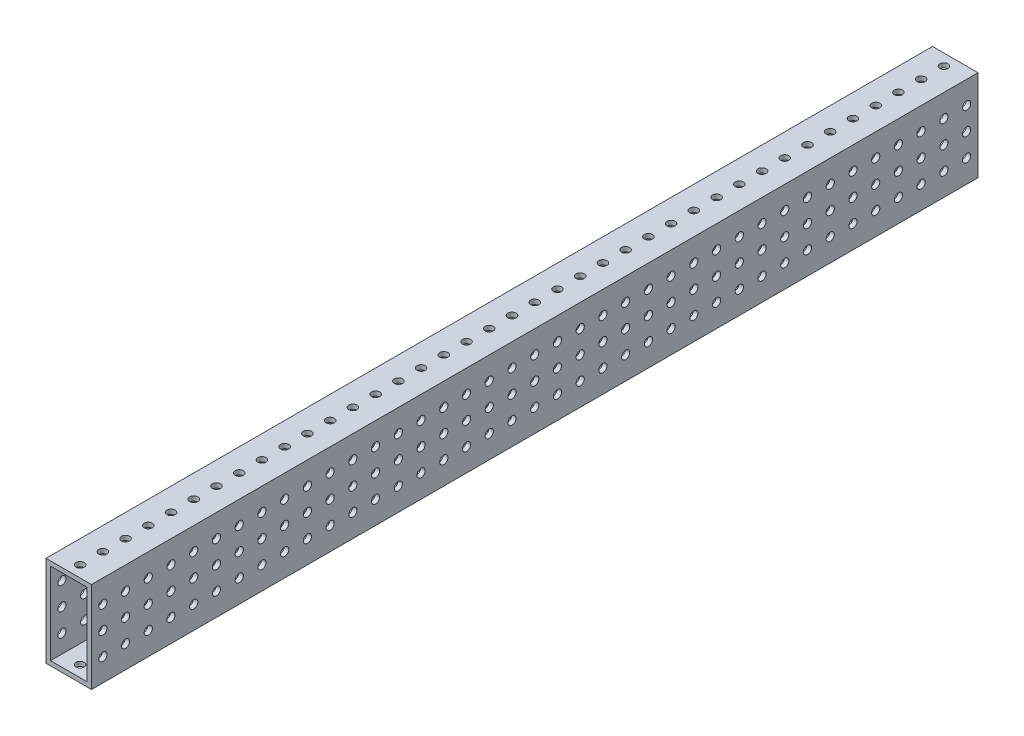
from build123d import *

# Parameters (mm, degrees)
SKETCH1_W           = 25.4
SKETCH1_H           = 50.8
SKETCH1_W_2         = 20.32
SKETCH1_H_2         = 45.72
BOSS_EXTRUDE1_DEPTH = 495.3
SKETCH2_R           = 2.286
CUT_EXTRUDE1_DEPTH  = 25.4
SKETCH4_R           = 2.286
CUT_EXTRUDE2_DEPTH  = 50.8


with BuildPart() as part:
    # Sketch1 → Boss-Extrude1 (new body)
    with BuildSketch(Plane.XY):
        with Locations((-11.984507042, -2.08685446)):
            Rectangle(SKETCH1_W, SKETCH1_H)
        with Locations((-11.984507042, -2.08685446)):
            Rectangle(SKETCH1_W_2, SKETCH1_H_2, mode=Mode.SUBTRACT)
    extrude(amount=BOSS_EXTRUDE1_DEPTH)

    # Sketch2 → Cut-Extrude1 (cut)
    with BuildSketch(Plane(origin=(0.715492958, 0, 0), x_dir=(0, 0, -1), z_dir=(1, 0, 0))):
        with Locations(Location((-488.95, 10.61314554, 0), (0, 0, 90))):
            Circle(SKETCH2_R)
        with Locations(Location((-476.25, 10.61314554, 0), (0, 0, 90))):
            Circle(SKETCH2_R)
        with Locations(Location((-463.55, 10.61314554, 0), (0, 0, 90))):
            Circle(SKETCH2_R)
        with Locations(Location((-450.85, 10.61314554, 0), (0, 0, 90))):
            Circle(SKETCH2_R)
        with Locations(Location((-438.15, 10.61314554, 0), (0, 0, 90))):
            Circle(SKETCH2_R)
        with Locations(Location((-425.45, 10.61314554, 0), (0, 0, 90))):
            Circle(SKETCH2_R)
        with Locations(Location((-412.75, 10.61314554, 0), (0, 0, 90))):
            Circle(SKETCH2_R)
        with Locations(Location((-400.05, 10.61314554, 0), (0, 0, 90))):
            Circle(SKETCH2_R)
        with Locations(Location((-387.35, 10.61314554, 0), (0, 0, 90))):
            Circle(SKETCH2_R)
        with Locations(Location((-374.65, 10.61314554, 0), (0, 0, 90))):
            Circle(SKETCH2_R)
        with Locations(Location((-361.95, 10.61314554, 0), (0, 0, 90))):
            Circle(SKETCH2_R)
        with Locations(Location((-349.25, 10.61314554, 0), (0, 0, 90))):
            Circle(SKETCH2_R)
        with Locations(Location((-336.55, 10.61314554, 0), (0, 0, 90))):
            Circle(SKETCH2_R)
        with Locations(Location((-323.85, 10.61314554, 0), (0, 0, 90))):
            Circle(SKETCH2_R)
        with Locations(Location((-311.15, 10.61314554, 0), (0, 0, 90))):
            Circle(SKETCH2_R)
        with Locations(Location((-298.45, 10.61314554, 0), (0, 0, 90))):
            Circle(SKETCH2_R)
        with Locations(Location((-285.75, 10.61314554, 0), (0, 0, 90))):
            Circle(SKETCH2_R)
        with Locations(Location((-273.05, 10.61314554, 0), (0, 0, 90))):
            Circle(SKETCH2_R)
        with Locations(Location((-260.35, 10.61314554, 0), (0, 0, 90))):
            Circle(SKETCH2_R)
        with Locations(Location((-247.65, 10.61314554, 0), (0, 0, 90))):
            Circle(SKETCH2_R)
        with Locations(Location((-234.95, 10.61314554, 0), (0, 0, 90))):
            Circle(SKETCH2_R)
        with Locations(Location((-222.25, 10.61314554, 0), (0, 0, 90))):
            Circle(SKETCH2_R)
        with Locations(Location((-209.55, 10.61314554, 0), (0, 0, 90))):
            Circle(SKETCH2_R)
        with Locations(Location((-196.85, 10.61314554, 0), (0, 0, 90))):
            Circle(SKETCH2_R)
        with Locations(Location((-184.15, 10.61314554, 0), (0, 0, 90))):
            Circle(SKETCH2_R)
        with Locations(Location((-171.45, 10.61314554, 0), (0, 0, 90))):
            Circle(SKETCH2_R)
        with Locations(Location((-158.75, 10.61314554, 0), (0, 0, 90))):
            Circle(SKETCH2_R)
        with Locations(Location((-146.05, 10.61314554, 0), (0, 0, 90))):
            Circle(SKETCH2_R)
        with Locations(Location((-133.35, 10.61314554, 0), (0, 0, 90))):
            Circle(SKETCH2_R)
        with Locations(Location((-120.65, 10.61314554, 0), (0, 0, 90))):
            Circle(SKETCH2_R)
        with Locations(Location((-107.95, 10.61314554, 0), (0, 0, 90))):
            Circle(SKETCH2_R)
        with Locations(Location((-95.25, 10.61314554, 0), (0, 0, 90))):
            Circle(SKETCH2_R)
        with Locations(Location((-82.55, 10.61314554, 0), (0, 0, 90))):
            Circle(SKETCH2_R)
        with Locations(Location((-69.85, 10.61314554, 0), (0, 0, 90))):
            Circle(SKETCH2_R)
        with Locations(Location((-57.15, 10.61314554, 0), (0, 0, 90))):
            Circle(SKETCH2_R)
        with Locations(Location((-44.45, 10.61314554, 0), (0, 0, 90))):
            Circle(SKETCH2_R)
        with Locations(Location((-31.75, 10.61314554, 0), (0, 0, 90))):
            Circle(SKETCH2_R)
        with Locations(Location((-19.05, 10.61314554, 0), (0, 0, 90))):
            Circle(SKETCH2_R)
        with Locations(Location((-6.35, 10.61314554, 0), (0, 0, 90))):
            Circle(SKETCH2_R)
        with Locations(Location((-476.25, -2.08685446, 0), (0, 0, 90))):
            Circle(SKETCH2_R)
        with Locations(Location((-463.55, -2.08685446, 0), (0, 0, 90))):
            Circle(SKETCH2_R)
        with Locations(Location((-450.85, -2.08685446, 0), (0, 0, 90))):
            Circle(SKETCH2_R)
        with Locations(Location((-438.15, -2.08685446, 0), (0, 0, 90))):
            Circle(SKETCH2_R)
        with Locations(Location((-425.45, -2.08685446, 0), (0, 0, 90))):
            Circle(SKETCH2_R)
        with Locations(Location((-412.75, -2.08685446, 0), (0, 0, 90))):
            Circle(SKETCH2_R)
        with Locations(Location((-400.05, -2.08685446, 0), (0, 0, 90))):
            Circle(SKETCH2_R)
        with Locations(Location((-387.35, -2.08685446, 0), (0, 0, 90))):
            Circle(SKETCH2_R)
        with Locations(Location((-374.65, -2.08685446, 0), (0, 0, 90))):
            Circle(SKETCH2_R)
        with Locations(Location((-361.95, -2.08685446, 0), (0, 0, 90))):
            Circle(SKETCH2_R)
        with Locations(Location((-349.25, -2.08685446, 0), (0, 0, 90))):
            Circle(SKETCH2_R)
        with Locations(Location((-336.55, -2.08685446, 0), (0, 0, 90))):
            Circle(SKETCH2_R)
        with Locations(Location((-323.85, -2.08685446, 0), (0, 0, 90))):
            Circle(SKETCH2_R)
        with Locations(Location((-311.15, -2.08685446, 0), (0, 0, 90))):
            Circle(SKETCH2_R)
        with Locations(Location((-298.45, -2.08685446, 0), (0, 0, 90))):
            Circle(SKETCH2_R)
        with Locations(Location((-285.75, -2.08685446, 0), (0, 0, 90))):
            Circle(SKETCH2_R)
        with Locations(Location((-273.05, -2.08685446, 0), (0, 0, 90))):
            Circle(SKETCH2_R)
        with Locations(Location((-260.35, -2.08685446, 0), (0, 0, 90))):
            Circle(SKETCH2_R)
        with Locations(Location((-247.65, -2.08685446, 0), (0, 0, 90))):
            Circle(SKETCH2_R)
        with Locations(Location((-234.95, -2.08685446, 0), (0, 0, 90))):
            Circle(SKETCH2_R)
        with Locations(Location((-222.25, -2.08685446, 0), (0, 0, 90))):
            Circle(SKETCH2_R)
        with Locations(Location((-209.55, -2.08685446, 0), (0, 0, 90))):
            Circle(SKETCH2_R)
        with Locations(Location((-196.85, -2.08685446, 0), (0, 0, 90))):
            Circle(SKETCH2_R)
        with Locations(Location((-184.15, -2.08685446, 0), (0, 0, 90))):
            Circle(SKETCH2_R)
        with Locations(Location((-171.45, -2.08685446, 0), (0, 0, 90))):
            Circle(SKETCH2_R)
        with Locations(Location((-158.75, -2.08685446, 0), (0, 0, 90))):
            Circle(SKETCH2_R)
        with Locations(Location((-146.05, -2.08685446, 0), (0, 0, 90))):
            Circle(SKETCH2_R)
        with Locations(Location((-133.35, -2.08685446, 0), (0, 0, 90))):
            Circle(SKETCH2_R)
        with Locations(Location((-120.65, -2.08685446, 0), (0, 0, 90))):
            Circle(SKETCH2_R)
        with Locations(Location((-107.95, -2.08685446, 0), (0, 0, 90))):
            Circle(SKETCH2_R)
        with Locations(Location((-95.25, -2.08685446, 0), (0, 0, 90))):
            Circle(SKETCH2_R)
        with Locations(Location((-82.55, -2.08685446, 0), (0, 0, 90))):
            Circle(SKETCH2_R)
        with Locations(Location((-69.85, -2.08685446, 0), (0, 0, 90))):
            Circle(SKETCH2_R)
        with Locations(Location((-57.15, -2.08685446, 0), (0, 0, 90))):
            Circle(SKETCH2_R)
        with Locations(Location((-44.45, -2.08685446, 0), (0, 0, 90))):
            Circle(SKETCH2_R)
        with Locations(Location((-31.75, -2.08685446, 0), (0, 0, 90))):
            Circle(SKETCH2_R)
        with Locations(Location((-19.05, -2.08685446, 0), (0, 0, 90))):
            Circle(SKETCH2_R)
        with Locations(Location((-6.35, -2.08685446, 0), (0, 0, 90))):
            Circle(SKETCH2_R)
        with Locations(Location((-476.25, -14.78685446, 0), (0, 0, 90))):
            Circle(SKETCH2_R)
        with Locations(Location((-463.55, -14.78685446, 0), (0, 0, 90))):
            Circle(SKETCH2_R)
        with Locations(Location((-450.85, -14.78685446, 0), (0, 0, 90))):
            Circle(SKETCH2_R)
        with Locations(Location((-438.15, -14.78685446, 0), (0, 0, 90))):
            Circle(SKETCH2_R)
        with Locations(Location((-425.45, -14.78685446, 0), (0, 0, 90))):
            Circle(SKETCH2_R)
        with Locations(Location((-412.75, -14.78685446, 0), (0, 0, 90))):
            Circle(SKETCH2_R)
        with Locations(Location((-400.05, -14.78685446, 0), (0, 0, 90))):
            Circle(SKETCH2_R)
        with Locations(Location((-387.35, -14.78685446, 0), (0, 0, 90))):
            Circle(SKETCH2_R)
        with Locations(Location((-374.65, -14.78685446, 0), (0, 0, 90))):
            Circle(SKETCH2_R)
        with Locations(Location((-361.95, -14.78685446, 0), (0, 0, 90))):
            Circle(SKETCH2_R)
        with Locations(Location((-349.25, -14.78685446, 0), (0, 0, 90))):
            Circle(SKETCH2_R)
        with Locations(Location((-336.55, -14.78685446, 0), (0, 0, 90))):
            Circle(SKETCH2_R)
        with Locations(Location((-323.85, -14.78685446, 0), (0, 0, 90))):
            Circle(SKETCH2_R)
        with Locations(Location((-311.15, -14.78685446, 0), (0, 0, 90))):
            Circle(SKETCH2_R)
        with Locations(Location((-298.45, -14.78685446, 0), (0, 0, 90))):
            Circle(SKETCH2_R)
        with Locations(Location((-285.75, -14.78685446, 0), (0, 0, 90))):
            Circle(SKETCH2_R)
        with Locations(Location((-273.05, -14.78685446, 0), (0, 0, 90))):
            Circle(SKETCH2_R)
        with Locations(Location((-260.35, -14.78685446, 0), (0, 0, 90))):
            Circle(SKETCH2_R)
        with Locations(Location((-247.65, -14.78685446, 0), (0, 0, 90))):
            Circle(SKETCH2_R)
        with Locations(Location((-234.95, -14.78685446, 0), (0, 0, 90))):
            Circle(SKETCH2_R)
        with Locations(Location((-222.25, -14.78685446, 0), (0, 0, 90))):
            Circle(SKETCH2_R)
        with Locations(Location((-209.55, -14.78685446, 0), (0, 0, 90))):
            Circle(SKETCH2_R)
        with Locations(Location((-196.85, -14.78685446, 0), (0, 0, 90))):
            Circle(SKETCH2_R)
        with Locations(Location((-184.15, -14.78685446, 0), (0, 0, 90))):
            Circle(SKETCH2_R)
        with Locations(Location((-171.45, -14.78685446, 0), (0, 0, 90))):
            Circle(SKETCH2_R)
        with Locations(Location((-158.75, -14.78685446, 0), (0, 0, 90))):
            Circle(SKETCH2_R)
        with Locations(Location((-146.05, -14.78685446, 0), (0, 0, 90))):
            Circle(SKETCH2_R)
        with Locations(Location((-133.35, -14.78685446, 0), (0, 0, 90))):
            Circle(SKETCH2_R)
        with Locations(Location((-120.65, -14.78685446, 0), (0, 0, 90))):
            Circle(SKETCH2_R)
        with Locations(Location((-107.95, -14.78685446, 0), (0, 0, 90))):
            Circle(SKETCH2_R)
        with Locations(Location((-95.25, -14.78685446, 0), (0, 0, 90))):
            Circle(SKETCH2_R)
        with Locations(Location((-82.55, -14.78685446, 0), (0, 0, 90))):
            Circle(SKETCH2_R)
        with Locations(Location((-69.85, -14.78685446, 0), (0, 0, 90))):
            Circle(SKETCH2_R)
        with Locations(Location((-57.15, -14.78685446, 0), (0, 0, 90))):
            Circle(SKETCH2_R)
        with Locations(Location((-44.45, -14.78685446, 0), (0, 0, 90))):
            Circle(SKETCH2_R)
        with Locations(Location((-31.75, -14.78685446, 0), (0, 0, 90))):
            Circle(SKETCH2_R)
        with Locations(Location((-19.05, -14.78685446, 0), (0, 0, 90))):
            Circle(SKETCH2_R)
        with Locations(Location((-6.35, -14.78685446, 0), (0, 0, 90))):
            Circle(SKETCH2_R)
        with Locations(Location((-488.95, -2.08685446, 0), (0, 0, 90))):
            Circle(SKETCH2_R)
        with Locations(Location((-488.95, -14.78685446, 0), (0, 0, 90))):
            Circle(SKETCH2_R)
    extrude(amount=-CUT_EXTRUDE1_DEPTH, mode=Mode.SUBTRACT)

    # Sketch4 → Cut-Extrude2 (cut)
    with BuildSketch(Plane(origin=(0, 23.31314554, 0), x_dir=(1, 0, 0), z_dir=(0, 1, 0))):
        with Locations(Location((-11.984507042, -6.35, 0), (0, 0, 180))):
            Circle(SKETCH4_R)
        with Locations(Location((-11.984507042, -19.05, 0), (0, 0, 180))):
            Circle(SKETCH4_R)
        with Locations(Location((-11.984507042, -31.75, 0), (0, 0, 180))):
            Circle(SKETCH4_R)
        with Locations(Location((-11.984507042, -44.45, 0), (0, 0, 180))):
            Circle(SKETCH4_R)
        with Locations(Location((-11.984507042, -57.15, 0), (0, 0, 180))):
            Circle(SKETCH4_R)
        with Locations(Location((-11.984507042, -69.85, 0), (0, 0, 180))):
            Circle(SKETCH4_R)
        with Locations(Location((-11.984507042, -82.55, 0), (0, 0, 180))):
            Circle(SKETCH4_R)
        with Locations(Location((-11.984507042, -95.25, 0), (0, 0, 180))):
            Circle(SKETCH4_R)
        with Locations(Location((-11.984507042, -107.95, 0), (0, 0, 180))):
            Circle(SKETCH4_R)
        with Locations(Location((-11.984507042, -120.65, 0), (0, 0, 180))):
            Circle(SKETCH4_R)
        with Locations(Location((-11.984507042, -133.35, 0), (0, 0, 180))):
            Circle(SKETCH4_R)
        with Locations(Location((-11.984507042, -146.05, 0), (0, 0, 180))):
            Circle(SKETCH4_R)
        with Locations(Location((-11.984507042, -158.75, 0), (0, 0, 180))):
            Circle(SKETCH4_R)
        with Locations(Location((-11.984507042, -171.45, 0), (0, 0, 180))):
            Circle(SKETCH4_R)
        with Locations(Location((-11.984507042, -184.15, 0), (0, 0, 180))):
            Circle(SKETCH4_R)
        with Locations(Location((-11.984507042, -196.85, 0), (0, 0, 180))):
            Circle(SKETCH4_R)
        with Locations(Location((-11.984507042, -209.55, 0), (0, 0, 180))):
            Circle(SKETCH4_R)
        with Locations(Location((-11.984507042, -222.25, 0), (0, 0, 180))):
            Circle(SKETCH4_R)
        with Locations(Location((-11.984507042, -234.95, 0), (0, 0, 180))):
            Circle(SKETCH4_R)
        with Locations(Location((-11.984507042, -247.65, 0), (0, 0, 180))):
            Circle(SKETCH4_R)
        with Locations(Location((-11.984507042, -260.35, 0), (0, 0, 180))):
            Circle(SKETCH4_R)
        with Locations(Location((-11.984507042, -273.05, 0), (0, 0, 180))):
            Circle(SKETCH4_R)
        with Locations(Location((-11.984507042, -285.75, 0), (0, 0, 180))):
            Circle(SKETCH4_R)
        with Locations(Location((-11.984507042, -298.45, 0), (0, 0, 180))):
            Circle(SKETCH4_R)
        with Locations(Location((-11.984507042, -311.15, 0), (0, 0, 180))):
            Circle(SKETCH4_R)
        with Locations(Location((-11.984507042, -323.85, 0), (0, 0, 180))):
            Circle(SKETCH4_R)
        with Locations(Location((-11.984507042, -336.55, 0), (0, 0, 180))):
            Circle(SKETCH4_R)
        with Locations(Location((-11.984507042, -349.25, 0), (0, 0, 180))):
            Circle(SKETCH4_R)
        with Locations(Location((-11.984507042, -361.95, 0), (0, 0, 180))):
            Circle(SKETCH4_R)
        with Locations(Location((-11.984507042, -374.65, 0), (0, 0, 180))):
            Circle(SKETCH4_R)
        with Locations(Location((-11.984507042, -387.35, 0), (0, 0, 180))):
            Circle(SKETCH4_R)
        with Locations(Location((-11.984507042, -400.05, 0), (0, 0, 180))):
            Circle(SKETCH4_R)
        with Locations(Location((-11.984507042, -412.75, 0), (0, 0, 180))):
            Circle(SKETCH4_R)
        with Locations(Location((-11.984507042, -425.45, 0), (0, 0, 180))):
            Circle(SKETCH4_R)
        with Locations(Location((-11.984507042, -438.15, 0), (0, 0, 180))):
            Circle(SKETCH4_R)
        with Locations(Location((-11.984507042, -450.85, 0), (0, 0, 180))):
            Circle(SKETCH4_R)
        with Locations(Location((-11.984507042, -463.55, 0), (0, 0, 180))):
            Circle(SKETCH4_R)
        with Locations(Location((-11.984507042, -476.25, 0), (0, 0, 180))):
            Circle(SKETCH4_R)
        with Locations(Location((-11.984507042, -488.95, 0), (0, 0, 180))):
            Circle(SKETCH4_R)
    extrude(amount=-CUT_EXTRUDE2_DEPTH, mode=Mode.SUBTRACT)


solid = part.part
